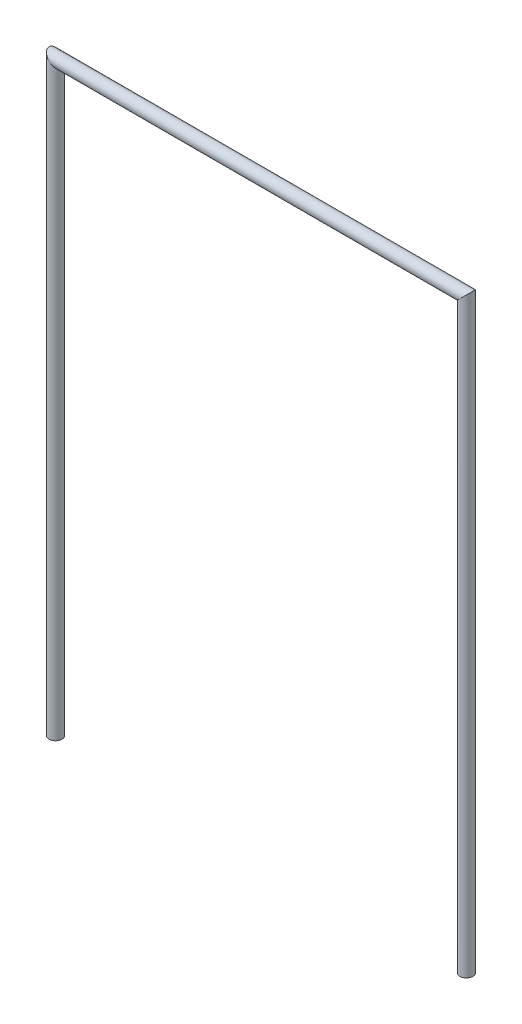
from build123d import *

# Parameters (mm, degrees)
SKETCH14_R                          = 109.5375
SKETCH14_R_2                        = 87.3125
PIPE_XX_STRONG_PIPE_XXS_8_1_DEPTH   = 10155.909418088
SKETCH14_ON_SEGMENT_2_R             = 109.5375
SKETCH14_ON_SEGMENT_2_R_2           = 87.3125
PIPE_XX_STRONG_PIPE_XXS_8_1_2_DEPTH = 7311.818836177
SKETCH14_ON_SEGMENT_3_R             = 109.5375
SKETCH14_ON_SEGMENT_3_R_2           = 87.3125
PIPE_XX_STRONG_PIPE_XXS_8_1_3_DEPTH = 10155.909418089


with BuildPart() as part:
    # Sketch14 → Pipe xx strong PIPE XXS 8(1) (new body)
    with BuildSketch(Plane(origin=(0, 0, 0), x_dir=(-1, 0, 0), z_dir=(0, 1, 0))):
        Circle(SKETCH14_R)
        Circle(SKETCH14_R_2, mode=Mode.SUBTRACT)
    extrude(amount=PIPE_XX_STRONG_PIPE_XXS_8_1_DEPTH)

    # Pipe xx strong PIPE XXS 8(1) mitre 1
    split(bisect_by=Plane(origin=(0, 10000, 0), x_dir=(0.707106781, -0.707106781, 0), z_dir=(-0.707106781, -0.707106781, 0)), keep=Keep.TOP)


with BuildPart() as body_2:
    # Sketch14 on segment 2 (carried to segment 2) → Pipe xx strong PIPE XXS 8_1 2 (new body)
    with BuildSketch(Plane(origin=(-155.909418088, 10000, 0), x_dir=(0, 1, 0), z_dir=(1, 0, 0))):
        Circle(SKETCH14_ON_SEGMENT_2_R)
        Circle(SKETCH14_ON_SEGMENT_2_R_2, mode=Mode.SUBTRACT)
    extrude(amount=PIPE_XX_STRONG_PIPE_XXS_8_1_2_DEPTH)

    # Pipe xx strong PIPE XXS 8_1 2 mitre 1
    split(bisect_by=Plane(origin=(0, 10000, 0), x_dir=(-0.707106781, 0.707106781, 0), z_dir=(0.707106781, 0.707106781, 0)), keep=Keep.TOP)

    # Pipe xx strong PIPE XXS 8_1 2 mitre 2
    split(bisect_by=Plane(origin=(7000, 10000, 0), x_dir=(-0.707106781, -0.707106781, 0), z_dir=(-0.707106781, 0.707106781, 0)), keep=Keep.TOP)


with BuildPart() as body_3:
    # Sketch14 on segment 3 (carried to segment 3) → Pipe xx strong PIPE XXS 8_1 3 (new body)
    with BuildSketch(Plane(origin=(7000, 10155.909418088, 0), x_dir=(1, 0, 0), z_dir=(0, -1, 0))):
        Circle(SKETCH14_ON_SEGMENT_3_R)
        Circle(SKETCH14_ON_SEGMENT_3_R_2, mode=Mode.SUBTRACT)
    extrude(amount=PIPE_XX_STRONG_PIPE_XXS_8_1_3_DEPTH)

    # Pipe xx strong PIPE XXS 8_1 3 mitre 1
    split(bisect_by=Plane(origin=(7000, 10000, 0), x_dir=(0.707106781, 0.707106781, 0), z_dir=(0.707106781, -0.707106781, 0)), keep=Keep.TOP)


solid = Compound([part.part, body_2.part, body_3.part])
